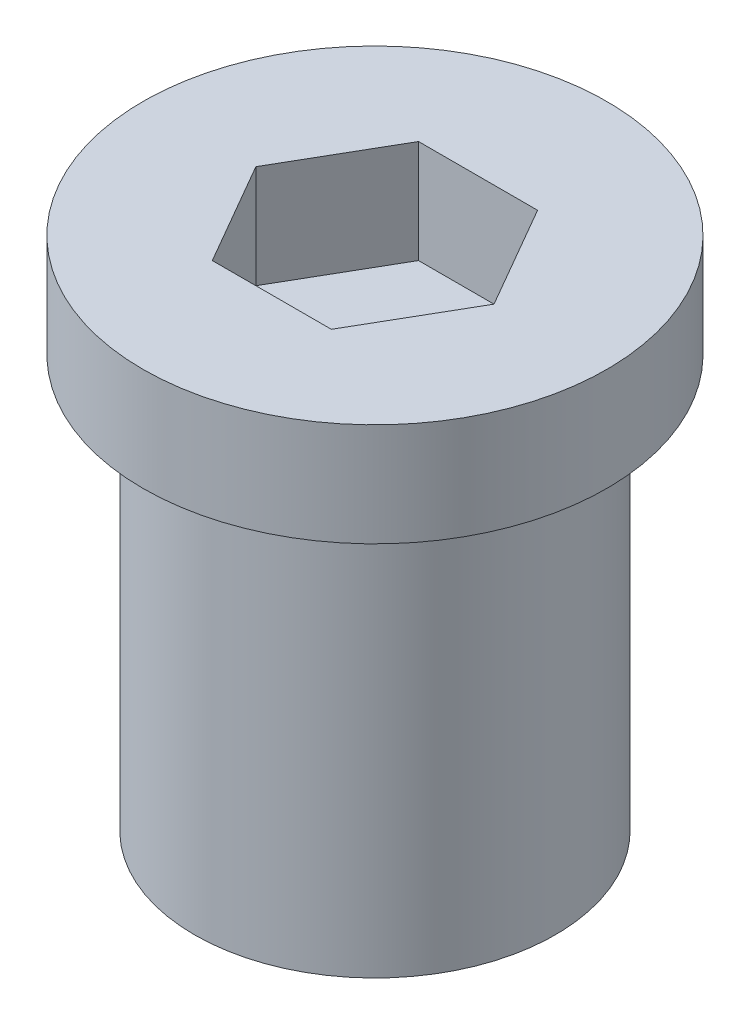
from build123d import *

# Parameters (mm, degrees)
SKETCH1_R           = 1.75
BOSS_EXTRUDE1_DEPTH = 2
SKETCH2_R           = 2.25
BOSS_EXTRUDE2_DEPTH = 1
CUT_EXTRUDE1_DEPTH  = 1


with BuildPart() as part:
    # Sketch1 → Boss-Extrude1 (new, symmetric)
    with BuildSketch(Plane(origin=(0, 0, 0), x_dir=(1, 0, 0), z_dir=(0, 1, 0))):
        with Locations(Location((0, 0, 0), (0, 0, 270))):
            Circle(SKETCH1_R)
    extrude(amount=BOSS_EXTRUDE1_DEPTH, both=True)

    # Sketch2 → Boss-Extrude2 (add)
    with BuildSketch(Plane(origin=(0, 2, 0), x_dir=(1, 0, 0), z_dir=(0, 1, 0))):
        with Locations(Location((0, 0, 0), (0, 0, 270))):
            Circle(SKETCH2_R)
    extrude(amount=BOSS_EXTRUDE2_DEPTH)

    # Sketch3 → Cut-Extrude1 (cut)
    with BuildSketch(Plane(origin=(0, 3, 0), x_dir=(1, 0, 0), z_dir=(0, 1, 0))):
        Polygon((1.154700538, 0), (0.577350269, 1), (-0.577350269, 1), (-1.154700538, 0), (-0.577350269, -1), (0.577350269, -1), align=None)
    extrude(amount=-CUT_EXTRUDE1_DEPTH, mode=Mode.SUBTRACT)


solid = part.part
